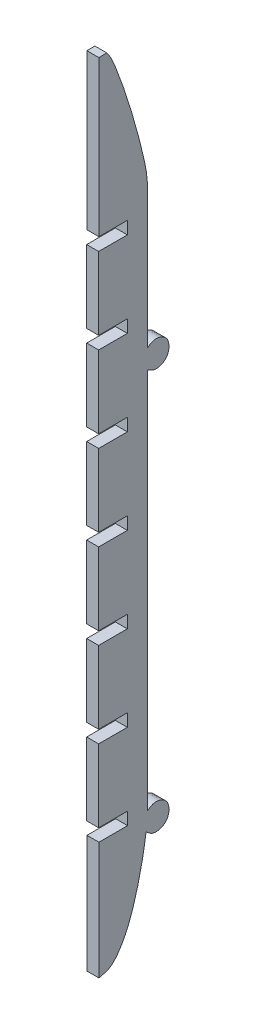
from build123d import *

# Parameters (mm, degrees)
SALIENTE_EXTRUIR1_DEPTH = 2.7


with BuildPart() as part:
    # Croquis1 → Saliente-Extruir1 (new body)
    with BuildSketch(Plane.YZ):
        with BuildLine():
            Line((-22.110629153, -6.418985628), (-19.260629153, -6.418985628))
            Line((-19.260629153, -6.418985628), (-19.260629153, 0.059451181))
            Line((-19.260629153, 0.059451181), (-2.849889186, 0.059451181))
            Line((-2.849889186, 0.059451181), (-2.849889186, -6.418985628))
            Line((-2.849889186, -6.418985628), (0.000110814, -6.418985628))
            Line((0.000110814, -6.418985628), (0.000110814, 0.059451181))
            Line((0.000110814, 0.059451181), (16.410672264, 0.059451181))
            Line((16.410672264, 0.059451181), (16.410672264, -6.418985628))
            Line((16.410672264, -6.418985628), (19.260672264, -6.418985628))
            Line((19.260672264, -6.418985628), (19.260672264, 0.059451181))
            Line((19.260672264, 0.059451181), (35.671322972, 0.059451181))
            Line((35.671322972, 0.059451181), (35.671322972, -6.418985628))
            Line((35.671322972, -6.418985628), (38.521322972, -6.418985628))
            Line((38.521322972, -6.418985628), (38.521322972, 0.059451181))
            Line((38.521322972, 0.059451181), (54.93197368, 0.059451181))
            Line((54.93197368, 0.059451181), (54.93197368, -6.418985628))
            Line((54.93197368, -6.418985628), (57.78197368, -6.418985628))
            Line((57.78197368, -6.418985628), (57.78197368, 0))
            Line((57.78197368, 0), (92.811977714, 0))
            Line((92.811977714, 0), (92.840089973, -1.785119122))
            add(Edge.make_bspline(
                [(92.840089973, -1.785119122), (92.447237265, -2.064666353), (91.562107852, -2.694545376), (89.213895552, -3.700289956), (84.249349165, -5.617278564), (76.749898692, -7.957987248), (69.681676617, -9.820364855), (65.065941011, -10.77280706), (63.481529507, -10.891366405), (62.824262201, -10.940548819)],
                knots=[0, 0, 0, 0, 0.045739515, 0.103060799, 0.241853729, 0.552585532, 0.849009834, 0.937364189, 1, 1, 1, 1], degree=3))
            Line((62.824262201, -10.940548819), (30.594296183, -10.940548819))
            add(Edge.make_bspline(
                [(30.594296183, -10.940548819), (30.921447359, -11.442137244), (31.555538234, -12.414367523), (31.268248789, -14.173159627), (30.182416548, -15.592511875), (29.034537635, -15.791382717), (28.440778339, -15.894254382)],
                knots=[0, 0, 0, 0, 0.257583929, 0.499275666, 0.740985929, 1, 1, 1, 1], degree=3))
            add(Edge.make_bspline(
                [(28.440778339, -15.894254382), (27.847016865, -15.79138162), (26.69915531, -15.59250767), (25.61335925, -14.173151066), (25.326077358, -12.414363927), (25.960178406, -11.442136771), (26.287321547, -10.940548819)],
                knots=[0, 0, 0, 0, 0.259010563, 0.500720038, 0.74241327, 1, 1, 1, 1], degree=3))
            Line((26.287321547, -10.940548819), (-59.95124774, -10.940548819))
            add(Edge.make_bspline(
                [(-59.95124774, -10.940548819), (-59.624096976, -11.442137347), (-58.990006223, -12.414367218), (-59.277284868, -14.1731508), (-60.363078616, -15.592503731), (-61.510934237, -15.79138053), (-62.104659968, -15.894254382)],
                knots=[0, 0, 0, 0, 0.257586595, 0.499280522, 0.740990692, 1, 1, 1, 1], degree=3))
            add(Edge.make_bspline(
                [(-62.104659968, -15.894254382), (-62.737656591, -15.777608826), (-63.958163548, -15.552699707), (-65.026875083, -13.971822996), (-65.172920695, -12.072708959), (-64.363662916, -11.135174473), (-63.944611922, -10.649752914)],
                knots=[0, 0, 0, 0, 0.259500482, 0.500353607, 0.74130111, 1, 1, 1, 1], degree=3))
            add(Edge.make_bspline(
                [(-63.944611922, -10.649752914), (-65.124297825, -10.468220396), (-67.923268081, -10.037509037), (-72.470849105, -9.093983121), (-78.212469404, -7.520495573), (-83.096036068, -5.527641263), (-86.600780666, -2.667344706), (-87.002807809, -0.84127357), (-87.188022286, 0)],
                knots=[0, 0, 0, 0, 0.133262352, 0.316183621, 0.518474271, 0.796547325, 0.906269063, 1, 1, 1, 1], degree=3))
            Line((-87.188022286, 0), (-60.631930569, 0))
            Line((-60.631930569, 0), (-60.631930569, -6.478436809))
            Line((-60.631930569, -6.478436809), (-57.781930569, -6.478436809))
            Line((-57.781930569, -6.478436809), (-57.781930569, 0.059451181))
            Line((-57.781930569, 0.059451181), (-41.371279861, 0.059451181))
            Line((-41.371279861, 0.059451181), (-41.371279861, -6.418985628))
            Line((-41.371279861, -6.418985628), (-38.521279861, -6.418985628))
            Line((-38.521279861, -6.418985628), (-38.521279861, 0.059451181))
            Line((-38.521279861, 0.059451181), (-22.110629153, 0.059451181))
            Line((-22.110629153, 0.059451181), (-22.110629153, -6.418985628))
        make_face()
    extrude(amount=SALIENTE_EXTRUIR1_DEPTH)


solid = part.part
